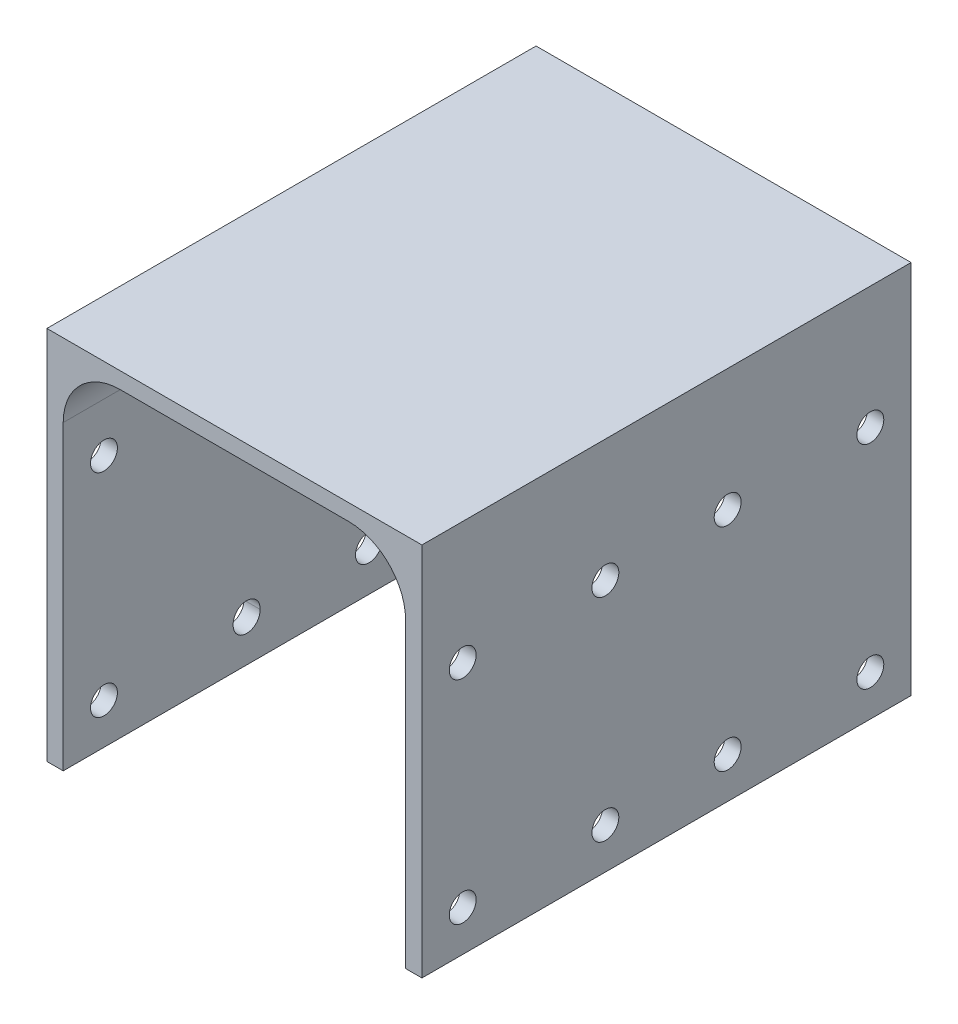
from build123d import *

# Parameters (mm, degrees)
SKETCH_1_W                  = 46
SKETCH_1_H                  = 60
EXTRUDE_1_DEPTH             = 46
SKETCH_2_W                  = 42
SKETCH_2_H                  = 44
CUT_EXTRUDE_1_DEPTH         = 69.249542123
HOLE_WIZARD_3_3_3_3_1_D     = 3.3
HOLE_WIZARD_3_3_3_3_1_DEPTH = 2
HOLE_WIZARD_3_3_3_3_2_D     = 3.3
HOLE_WIZARD_3_3_3_3_2_DEPTH = 46
FILLET_1_R                  = 7


with BuildPart() as part:
    # 草图1 → 凸台-拉伸1 (new body)
    with BuildSketch(Plane.XZ.offset(23)):
        with Locations((0, 30)):
            Rectangle(SKETCH_1_W, SKETCH_1_H)
    extrude(amount=-EXTRUDE_1_DEPTH)

    # 草图2 → 切除-拉伸1 (cut, through all)
    with BuildSketch(Plane.XY.offset(60)):
        with Locations((0, -1)):
            Rectangle(SKETCH_2_W, SKETCH_2_H)
    extrude(amount=-CUT_EXTRUDE_1_DEPTH, mode=Mode.SUBTRACT)

    # Ø3.3 (3.3) 直径孔1
    with Locations(Plane.ZY.offset(23)):
        with Locations((55, -18), (22.5, -18), (22.5, 8), (55, 8), (5, 8), (37.5, 8), (37.5, -17.819824414), (5, -18)):
            Hole(HOLE_WIZARD_3_3_3_3_1_D / 2, depth=HOLE_WIZARD_3_3_3_3_1_DEPTH)

    # Ø3.3 (3.3) 直径孔2
    with Locations(Plane(origin=(23, 0, 0), x_dir=(0, 0, -1), z_dir=(1, 0, 0))):
        with Locations((-55, 8), (-22.5, 8), (-22.5, -18), (-55, -18), (-5, -18), (-5, 8), (-37.5, 8), (-37.5, -18)):
            Hole(HOLE_WIZARD_3_3_3_3_2_D / 2, depth=HOLE_WIZARD_3_3_3_3_2_DEPTH)

    # 圆角1
    fillet_1_edges = [part.edges().sort_by_distance(p)[0] for p in [
        (-21, 21, 30),
        (21, 21, 30),
    ]]
    fillet(fillet_1_edges, radius=FILLET_1_R)


solid = part.part
